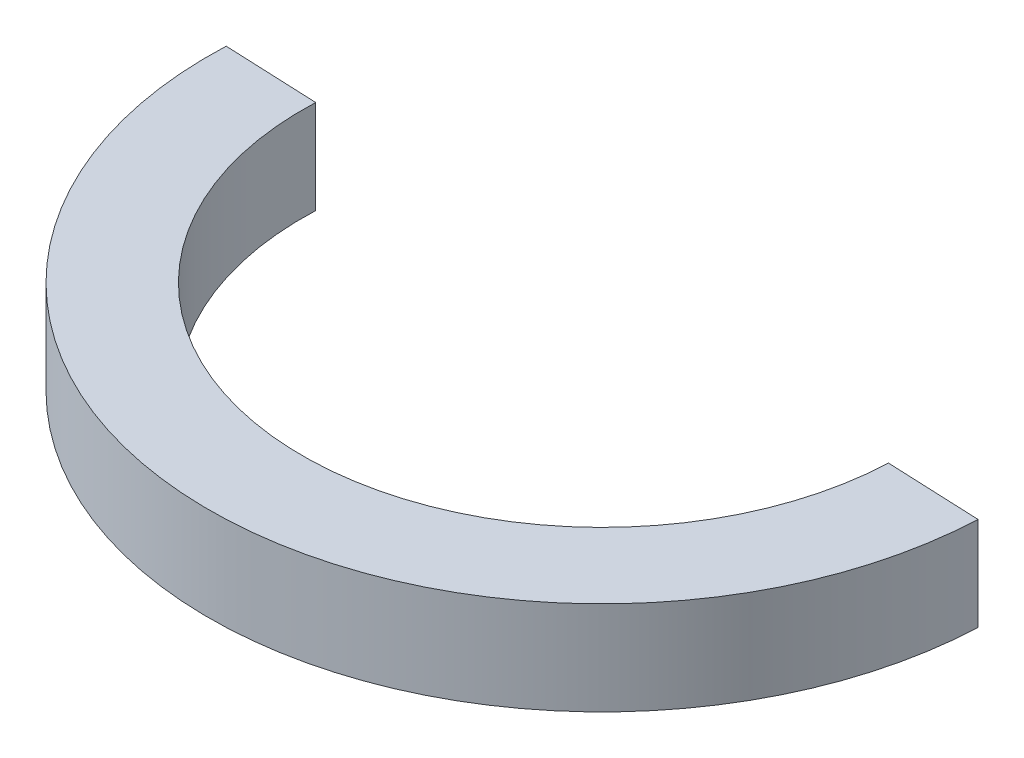
from build123d import *

# Parameters (mm, degrees)
EXTRUDE_1_DEPTH = 10


with BuildPart() as part:
    # Эскиз2 → Вытянуть-Тонкостенный1 (new body)
    with BuildSketch(Plane(origin=(0, 0, 0), x_dir=(1, 0, 0), z_dir=(0, 1, 0))):
        with BuildLine():
            ThreePointArc((-31.970168273, 1.381427024), (-1.381427024, -31.970168273), (31.970168273, -1.381427024))
            Line((31.970168273, -1.381427024), (41.960845858, -1.813122969))
            ThreePointArc((41.960845858, -1.813122969), (-1.813122969, -41.960845858), (-41.960845858, 1.813122969))
            Line((-41.960845858, 1.813122969), (-31.970168273, 1.381427024))
        make_face()
    extrude(amount=EXTRUDE_1_DEPTH)


solid = part.part
